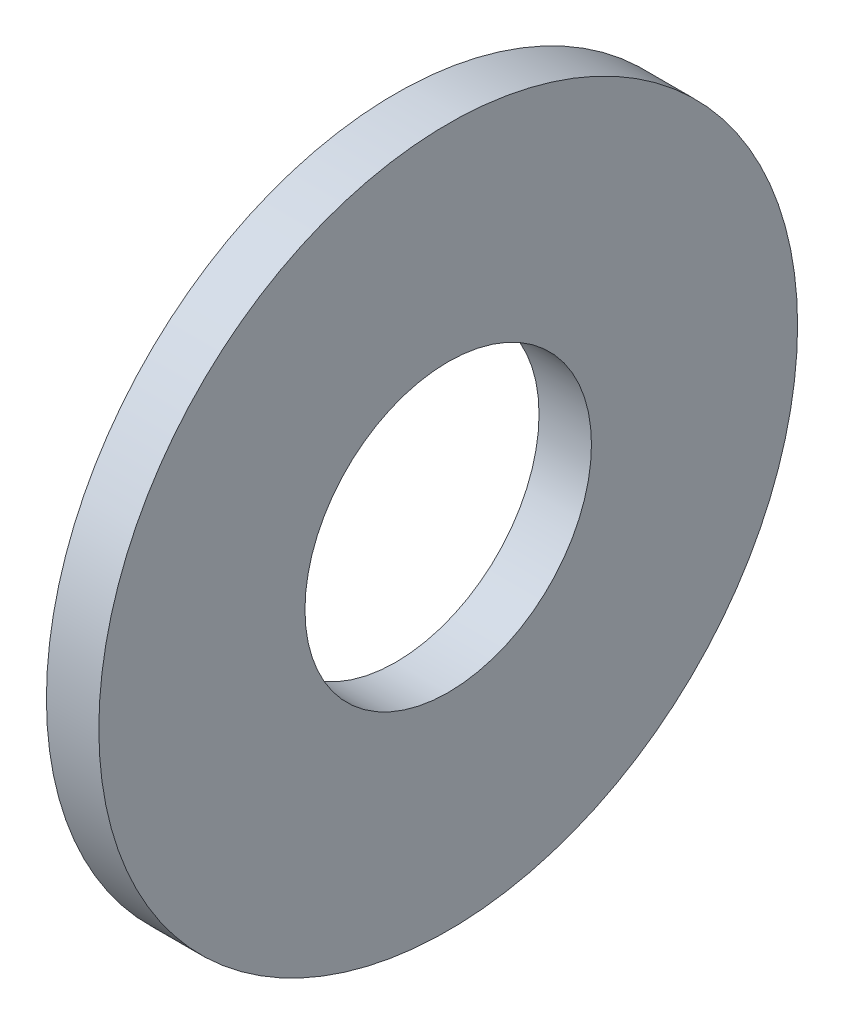
from build123d import *

# Parameters (mm, degrees)
SKETCH1_W = 1.5
SKETCH1_H = 5.9


with BuildPart() as part:
    # Sketch1 → Revolve1 (revolve)
    with BuildSketch(Plane(origin=(0, 0, 0), x_dir=(1, 0, 0), z_dir=(0, 1, 0)), mode=Mode.PRIVATE) as revolve1_sk:
        with Locations((0.0374, 7.05)):
            Rectangle(SKETCH1_W, SKETCH1_H)
    revolve(revolve1_sk.sketch.rotate(Axis((-0.7874, 0, 0), (1, 0, 0)), 180), axis=Axis((-0.7874, 0, 0), (1, 0, 0)))


solid = part.part
